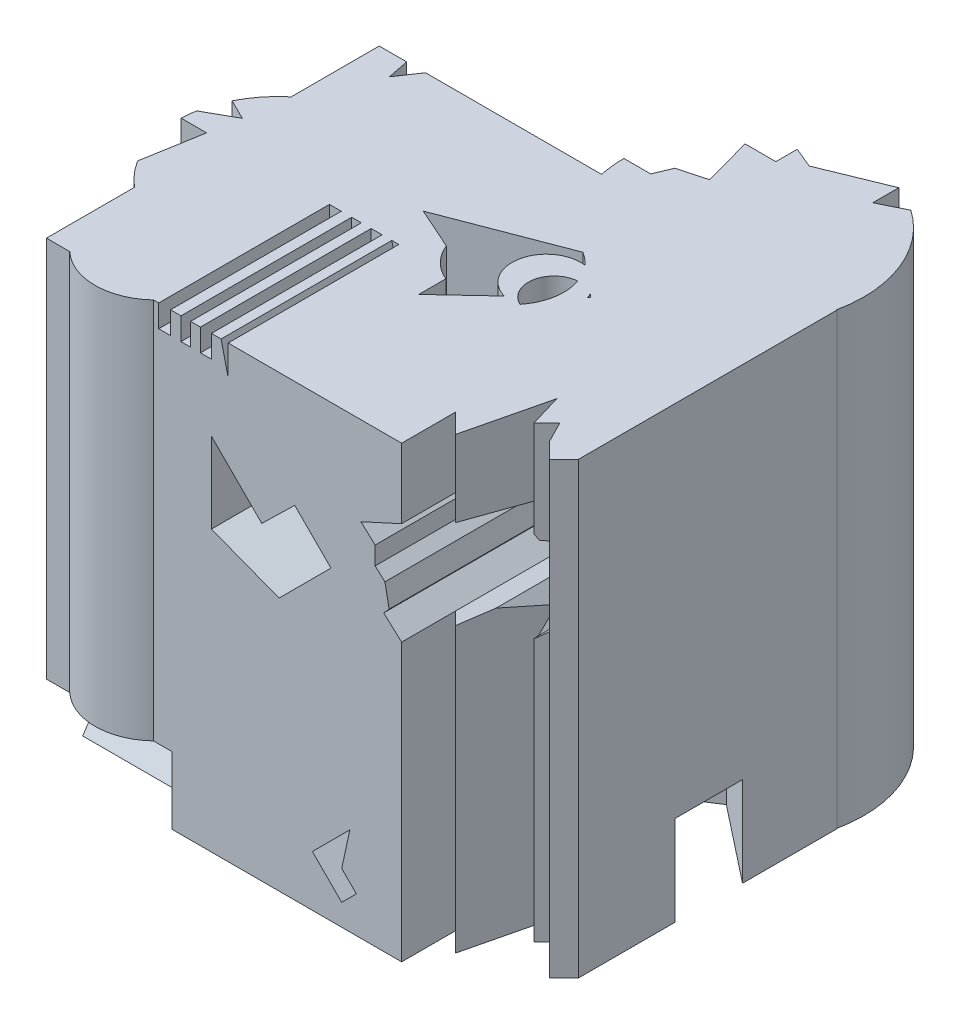
from build123d import *

# Parameters (mm, degrees)
BOSS_EXTRUDE1_DEPTH = 127
CUT_EXTRUDE1_DEPTH  = 127
CUT_EXTRUDE2_DEPTH  = 127
CUT_EXTRUDE3_DEPTH  = 127
CUT_EXTRUDE4_DEPTH  = 127
CUT_EXTRUDE5_DEPTH  = 35.56
CUT_EXTRUDE6_DEPTH  = 45.72
CUT_EXTRUDE7_DEPTH  = 25.4
CUT_EXTRUDE8_DEPTH  = 25.4
CUT_EXTRUDE9_DEPTH  = 48.26
FILLET2_R           = 12.7
CUT_EXTRUDE10_DEPTH = 48.26
CUT_EXTRUDE11_DEPTH = 48.26
SKETCH13_W          = 3.352326168
SKETCH13_H          = 6.321243204
SKETCH13_W_2        = 2.726283313
SKETCH13_W_3        = 3.104310258
CUT_EXTRUDE12_DEPTH = 48.26


with BuildPart() as part:
    # Sketch1 → Boss-Extrude1 (new body)
    with BuildSketch(Plane(origin=(0, 0, 0), x_dir=(1, 0, 0), z_dir=(0, 1, 0))):
        with BuildLine():
            Line((-46.648149315, -23.52267691), (-46.648149315, -48.412154961))
            Line((-46.648149315, -48.412154961), (-40.062268629, -48.412154961))
            ThreePointArc((-40.062268629, -48.412154961), (-28.224090342, -53.116170018), (-16.385912055, -48.412154961))
            Line((-16.385912055, -48.412154961), (82.712264752, -48.412154961))
            Line((82.712264752, -48.412154961), (82.712264752, 45.668146178))
            Line((82.712264752, 45.668146178), (82.57362293, 45.668146178))
            ThreePointArc((82.57362293, 45.668146178), (49.392158098, 86.647568698), (16.210693266, 45.668146178))
            Line((16.210693266, 45.668146178), (-46.648149315, 45.668146178))
            Line((-46.648149315, 45.668146178), (-46.648149315, 20.778668127))
            ThreePointArc((-46.648149315, 20.778668127), (-57.035515889, -1.372004392), (-46.648149315, -23.52267691))
        make_face()
    extrude(amount=BOSS_EXTRUDE1_DEPTH)

    # Sketch2 → Cut-Extrude1 (cut)
    with BuildSketch(Plane(origin=(0, 127, 0), x_dir=(1, 0, 0), z_dir=(0, 1, 0))):
        Polygon((53.771255125, -48.412154961), (53.771255125, -33.133056701), (59.245344615, -38.607146191), (64.805708774, -15.565956225), (67.56040543, -24.817995886), (71.210896888, -21.167504428), (74.240128171, -27.086551208), (78.610346891, -31.456769928), (82.712264752, -27.354852067), (82.712264752, -48.412154961), align=None)
    extrude(amount=-CUT_EXTRUDE1_DEPTH, mode=Mode.SUBTRACT)

    # Sketch3 → Cut-Extrude2 (cut)
    with BuildSketch(Plane(origin=(0, 127, 0), x_dir=(1, 0, 0), z_dir=(0, 1, 0))):
        Polygon((-54.021260569, 11.457814404), (-48.290157028, 8.607539769), (-56.529413656, 4.004510667), (-59.573272313, 8.607539769), align=None)
    extrude(amount=-CUT_EXTRUDE2_DEPTH, mode=Mode.SUBTRACT)

    # Sketch4 → Cut-Extrude3 (cut)
    with BuildSketch(Plane(origin=(0, 127, 0), x_dir=(1, 0, 0), z_dir=(0, 1, 0))):
        Polygon((68.711913571, 80.608646732), (61.499352783, 77.062236982), (61.499352783, 84.413487152), (43.506651189, 77.062236982), (37.732058212, 79.486880591), (37.732058212, 73.421951288), (29.019187448, 73.421951288), (32.795774648, 59.641721258), (25.052672929, 57.519659523), (23.039136033, 52.724168763), (15.468758164, 52.724168763), (7.703729169, 71.729623121), (36.607461416, 93.948488974), (52.503001986, 98.304794706), (65.105633177, 93.013185532), (69.999007684, 86.647568698), align=None)
    extrude(amount=-CUT_EXTRUDE3_DEPTH, mode=Mode.SUBTRACT)

    # Sketch5 → Cut-Extrude4 (cut)
    with BuildSketch(Plane.XY.offset(48.412154961)):
        Polygon((23.551684909, 96.675783769), (33.794948234, 86.432520444), (19.119619253, 71.757191462), (0, 79.094855953), (0, 101.828672261), (14.231003477, 87.597668784), align=None)
    extrude(amount=-CUT_EXTRUDE4_DEPTH, mode=Mode.SUBTRACT)

    # Sketch6 → Cut-Extrude5 (cut)
    with BuildSketch(Plane.ZY.offset(46.648149315)):
        Polygon((38.182028022, 0), (33.400703039, 7.024347662), (37.217405556, 9.622296393), (35.309054298, 16.783843232), (38.182028022, 16.783843232), (40.605664491, 14.360206762), (44.842860178, 18.597402448), (44.842860178, 22.591859045), (48.412154961, 19.022564262), (59.012556324, 19.022564262), (59.012556324, 0), (48.412154961, 0), align=None)
    extrude(amount=-CUT_EXTRUDE5_DEPTH, mode=Mode.SUBTRACT)

    # Sketch7 → Cut-Extrude6 (cut)
    with BuildSketch(Plane.XY.offset(48.412154961)):
        Polygon((39.132383475, 25.016517963), (28.526826147, 14.410960635), (36.827561927, 6.110224855), (40.977929817, 10.260592745), (36.827561927, 14.410960635), align=None)
    extrude(amount=-CUT_EXTRUDE6_DEPTH, mode=Mode.SUBTRACT)

    # Sketch8 → Cut-Extrude7 (cut)
    with BuildSketch(Plane(origin=(0, 127, 0), x_dir=(1, 0, 0), z_dir=(0, 1, 0))):
        with BuildLine():
            Line((-57.002829821, 0), (-49.785263054, 0))
            Line((-49.785263054, 0), (-52.666628039, -16.625220216))
            ThreePointArc((-52.666628039, -16.625220216), (-57.55914693, -15.494773831), (-62.296457645, -13.829680042))
            Line((-62.296457645, -13.829680042), (-57.002829821, 0))
        make_face()
    extrude(amount=-CUT_EXTRUDE7_DEPTH, mode=Mode.SUBTRACT)

    # Sketch9 → Cut-Extrude8 (cut)
    with BuildSketch(Plane.XZ):
        Polygon((82.712264752, 0), (39.607419236, -9.156647056), (54.793750982, -19.021436188), (48.928269368, -28.051041225), (61.159841994, -35.996467858), (82.712264752, -19.021436188), align=None)
    extrude(amount=-CUT_EXTRUDE8_DEPTH, mode=Mode.SUBTRACT)

    # Sketch10 → Cut-Extrude9 (cut)
    with BuildSketch(Plane.XY.offset(48.412154961)):
        Polygon((53.771255125, 107.29121559), (42.256216165, 102.017164953), (46.287188011, 98.336825396), (46.287188011, 93.216188047), (49.045405549, 90.697892831), (50.235317507, 84.59608405), (48.703232752, 82.918034942), (53.771255125, 78.290852235), (61.466936814, 80.968679424), (67.014073164, 73.774503757), (72.871402474, 78.290852235), (77.043238703, 83.646506612), (69.697413806, 84.59608405), (76.045391143, 89.490751273), (72.68469634, 93.849293635), (77.043238703, 97.209988438), (68.326153978, 98.336825396), (66.050570011, 103.030602234), align=None)
    extrude(amount=-CUT_EXTRUDE9_DEPTH, mode=Mode.SUBTRACT)

    # Fillet2
    fillet2_edges = [part.edges().sort_by_distance(p)[0] for p in [
        (-15.218728024, 0, -45.668146178),
    ]]
    fillet(fillet2_edges, radius=FILLET2_R)

    # Sketch11 → Cut-Extrude10 (cut)
    with BuildSketch(Plane(origin=(0, 127, 0), x_dir=(1, 0, 0), z_dir=(0, 1, 0))):
        Polygon((-33.561061306, 45.668146178), (-37.667043384, 39.545827315), (-38.873955148, 45.668146178), align=None)
    extrude(amount=-CUT_EXTRUDE10_DEPTH, mode=Mode.SUBTRACT)

    # Sketch12 → Cut-Extrude11 (cut)
    with BuildSketch(Plane(origin=(0, 127, 0), x_dir=(1, 0, 0), z_dir=(0, 1, 0))):
        with BuildLine():
            Line((32.62261169, 23.954039897), (0, 11.47123499))
            Line((0, 11.47123499), (11.785114171, 6.209119257))
            ThreePointArc((11.785114171, 6.209119257), (14.943546446, 1.324840992), (19.768883298, -1.922926376))
            Line((19.768883298, -1.922926376), (19.768883298, -9.559025438))
            Line((19.768883298, -9.559025438), (32.25248958, 2.120086108))
            ThreePointArc((32.25248958, 2.120086108), (25.311240294, 13.407729102), (36.117063667, 21.077540525))
            ThreePointArc((36.117063667, 21.077540525), (34.482898742, 22.653139956), (32.62261169, 23.954039897))
        make_face()
        with BuildLine():
            Line((44.311200133, 13.401683946), (44.859521729, 13.914669452))
            ThreePointArc((44.859521729, 13.914669452), (44.41506933, 14.350797491), (43.935008387, 14.747391861))
            ThreePointArc((43.935008387, 14.747391861), (44.147380403, 14.081324283), (44.311200133, 13.401683946))
        make_face()
        with BuildLine():
            ThreePointArc((36.497852258, 2.312544405), (39.537766596, 8.935870024), (38.967288817, 16.201135094))
            ThreePointArc((38.967288817, 16.201135094), (32.362672824, 10.211625014), (36.497852258, 2.312544405))
        make_face()
    extrude(amount=-CUT_EXTRUDE11_DEPTH, mode=Mode.SUBTRACT)

    # Sketch13 → Cut-Extrude12 (cut)
    with BuildSketch(Plane.XY.offset(48.412154961)):
        with Locations((-13.231710861, 123.839378398)):
            Rectangle(SKETCH13_W, SKETCH13_H)
        with Locations((-7.25167366, 123.839378398)):
            Rectangle(SKETCH13_W_2, SKETCH13_H)
        with Locations((-1.552155129, 123.839378398)):
            Rectangle(SKETCH13_W_3, SKETCH13_H)
        Polygon((2.732268262, 127), (4.714756247, 127), (4.714756247, 118.574601007), align=None)
    extrude(amount=-CUT_EXTRUDE12_DEPTH, mode=Mode.SUBTRACT)


solid = part.part
